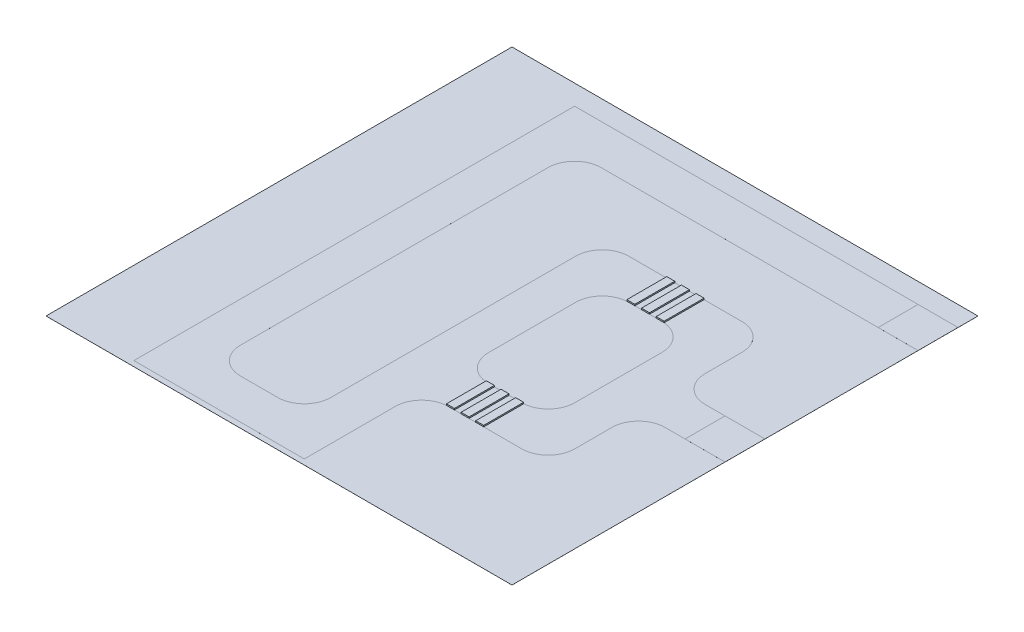
from build123d import *

# Parameters (mm, degrees)
SKETCH_2_W        = 3500
SKETCH_2_H        = 3500
EXTRUDE_1_DEPTH   = 0.1
EXTRUDE_3_DEPTH   = 0.11
SKETCH_4_W        = 300
SKETCH_4_H        = 300
EXTRUDE_4_DEPTH   = 0.12
SKETCH_5_W        = 300
SKETCH_5_H        = 300
EXTRUDE_5_DEPTH   = 0.13
SKETCH_6_W        = 60
SKETCH_6_H        = 300
EXTRUDE_6_DEPTH   = 10
EXTRUDE_6_2_DEPTH = 10
EXTRUDE_6_3_DEPTH = 10


with BuildPart() as part:
    # 草图2 → 凸台-拉伸1 (new body)
    with BuildSketch(Plane(origin=(0, 0, 0), x_dir=(1, 0, 0), z_dir=(0, 1, 0))):
        Rectangle(SKETCH_2_W, SKETCH_2_H)
    extrude(amount=EXTRUDE_1_DEPTH)

    # 草图3 → 凸台-拉伸3 (add)
    with BuildSketch(Plane(origin=(0, 0, 0), x_dir=(1, 0, 0), z_dir=(0, 1, 0))):
        with BuildLine():
            Line((1750, 1600), (-1130, 1600))
            Line((-1130, 1600), (-1130, -1710))
            Line((-1130, -1710), (150, -1710))
            Line((150, -1710), (150, -1027.5))
            ThreePointArc((150, -1027.5), (208.578643763, -886.078643763), (350, -827.5))
            Line((350, -827.5), (900, -827.5))
            ThreePointArc((900, -827.5), (1041.421356237, -768.921356237), (1100, -627.5))
            Line((1100, -627.5), (1100, -350))
            ThreePointArc((1100, -350), (1158.578643763, -208.578643763), (1300, -150))
            Line((1300, -150), (1750, -150))
            Line((1750, -150), (1750, 150))
            Line((1750, 150), (1300, 150))
            ThreePointArc((1300, 150), (1158.578643763, 208.578643763), (1100, 350))
            Line((1100, 350), (1100, 627.5))
            ThreePointArc((1100, 627.5), (1041.421356237, 768.921356237), (900, 827.5))
            Line((900, 827.5), (50, 827.5))
            ThreePointArc((50, 827.5), (-91.421356237, 768.921356237), (-150, 627.5))
            Line((-150, 627.5), (-150, -1210))
            ThreePointArc((-150, -1210), (-208.578643763, -1351.421356237), (-350, -1410))
            Line((-350, -1410), (-630, -1410))
            ThreePointArc((-630, -1410), (-771.421356237, -1351.421356237), (-830, -1210))
            Line((-830, -1210), (-830, 1100))
            ThreePointArc((-830, 1100), (-771.421356237, 1241.421356237), (-630, 1300))
            Line((-630, 1300), (1750, 1300))
            Line((1750, 1300), (1750, 1600))
        make_face()
        with BuildLine():
            Line((350, 527.5), (600, 527.5))
            ThreePointArc((600, 527.5), (741.421356237, 468.921356237), (800, 327.5))
            Line((800, 327.5), (800, -327.5))
            ThreePointArc((800, -327.5), (741.421356237, -468.921356237), (600, -527.5))
            Line((600, -527.5), (350, -527.5))
            ThreePointArc((350, -527.5), (208.578643763, -468.921356237), (150, -327.5))
            Line((150, -327.5), (150, 327.5))
            ThreePointArc((150, 327.5), (208.578643763, 468.921356237), (350, 527.5))
        make_face(mode=Mode.SUBTRACT)
    extrude(amount=EXTRUDE_3_DEPTH)

    # 草图4 → 凸台-拉伸4 (add)
    with BuildSketch(Plane(origin=(0, 0.1, 0), x_dir=(1, 0, 0), z_dir=(0, 1, 0))):
        with Locations((1600, 1450)):
            Rectangle(SKETCH_4_W, SKETCH_4_H)
    extrude(amount=EXTRUDE_4_DEPTH)

    # 草图5 → 凸台-拉伸5 (add)
    with BuildSketch(Plane(origin=(0, 0.1, 0), x_dir=(1, 0, 0), z_dir=(0, 1, 0))):
        with Locations((1600, 0)):
            Rectangle(SKETCH_5_W, SKETCH_5_H)
    extrude(amount=EXTRUDE_5_DEPTH)


with BuildPart() as body_2:
    # 草图6 → 凸台-拉伸6 (new body)
    with BuildSketch(Plane(origin=(-425.822723821, 0.1, 0), x_dir=(1, 0, 0), z_dir=(0, 1, 0))):
        with Locations((900.822723821, 677.5)):
            Rectangle(SKETCH_6_W, SKETCH_6_H)
    extrude_6 = extrude(amount=EXTRUDE_6_DEPTH)


with BuildPart() as body_3:
    # 草图6 → Extrude 6 2 (new body)
    with BuildSketch(Plane(origin=(-425.822723821, 0.1, 0), x_dir=(1, 0, 0), z_dir=(0, 1, 0))):
        with Locations((1010.822723821, 677.5)):
            Rectangle(SKETCH_6_W, SKETCH_6_H)
    extrude_6_2 = extrude(amount=EXTRUDE_6_2_DEPTH)


with BuildPart() as body_4:
    # 草图6 → Extrude 6 3 (new body)
    with BuildSketch(Plane(origin=(-425.822723821, 0.1, 0), x_dir=(1, 0, 0), z_dir=(0, 1, 0))):
        with Locations((790.822723821, 677.5)):
            Rectangle(SKETCH_6_W, SKETCH_6_H)
    extrude_6_3 = extrude(amount=EXTRUDE_6_3_DEPTH)


with BuildPart() as part_1:
    add(part.part)

    # 镜向1: 凸台-拉伸6, Extrude 6 2, Extrude 6 3 across plane
    add(extrude_6.mirror(Plane.XY))
    add(extrude_6_2.mirror(Plane.XY))
    add(extrude_6_3.mirror(Plane.XY))


solid = Compound([body_2.part, body_3.part, body_4.part, part_1.part])
